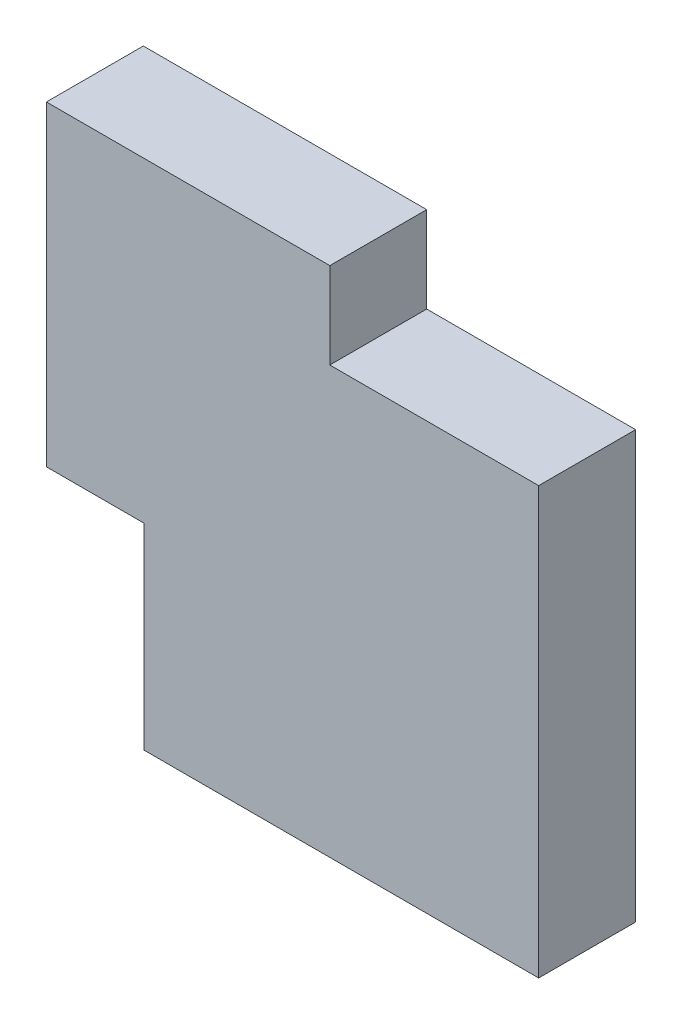
from build123d import *

# Parameters (mm, degrees)
BOSS_EXTRUDE1_DEPTH      = 20
BOSS_EXTRUDE1_DEPTH_BACK = 0.0001
SHELL3_T                 = 3.81
SKETCH9_R                = 1.072598704
BOSS_EXTRUDE3_DEPTH      = 3.001739429
SKETCH19_R               = 1.080792188
BOSS_EXTRUDE4_DEPTH      = 3
BOSS_EXTRUDE5_DEPTH      = 17.32
SKETCH22_W               = 1.806317066
SKETCH22_H               = 1.967276013
SKETCH22_W_2             = 1.806317067
CUT_EXTRUDE1_DEPTH       = 5


with BuildPart() as part:
    # Sketch2 → Boss-Extrude1 (new, two sides: drawn at the far end of the back side and taken through both)
    with BuildSketch(Plane.XY.offset(-BOSS_EXTRUDE1_DEPTH_BACK)):
        Polygon((-6.655720012, 48.566419982), (44.654279988, 48.566419982), (44.654279988, -48.566419982), (-44.654279988, -48.566419982), (-44.654279988, -0.283580018), (-68.655720012, -0.283580018), (-68.655720012, 69.716419982), (-6.655720012, 69.716419982), align=None)
    extrude(amount=BOSS_EXTRUDE1_DEPTH + BOSS_EXTRUDE1_DEPTH_BACK)

    # Shell3
    shell3_openings = [part.faces().sort_by_distance(p)[0] for p in [
        (-10.378060189, 9.486636378, -0.0001),
    ]]
    offset(amount=SHELL3_T, openings=shell3_openings, kind=Kind.INTERSECTION)

    # Sketch9 → Boss-Extrude3 (add)
    with BuildSketch(Plane(origin=(0, 0, 20), x_dir=(-1, 0, 0), z_dir=(0, 0, -1))):
        with BuildLine():
            Line((-44.654279988, 48.566419982), (-38.360252923, 48.566419982))
            ThreePointArc((-38.360252923, 48.566419982), (-40.203730769, 44.115870764), (-44.654279988, 42.272392917))
            Line((-44.654279988, 42.272392917), (-44.654279988, 48.566419982))
        make_face()
        with Locations((-42.441033376, 46.349593762)):
            Circle(SKETCH9_R, mode=Mode.SUBTRACT)
    boss_extrude3 = extrude(amount=BOSS_EXTRUDE3_DEPTH)

    # Mirror1: Boss-Extrude3 across plane
    add(boss_extrude3.mirror(Plane.ZX))

    # Sketch19 → Boss-Extrude4 (add)
    with BuildSketch(Plane(origin=(0, 0, 20), x_dir=(-1, 0, 0), z_dir=(0, 0, -1))):
        with BuildLine():
            ThreePointArc((44.654279988, -43.211645674), (40.867882763, -44.780022757), (39.29950568, -48.566419982))
            Line((39.29950568, -48.566419982), (44.654279988, -48.566419982))
            Line((44.654279988, -48.566419982), (44.654279988, -43.211645674))
        make_face()
        with Locations((42.445754047, -46.356290661)):
            Circle(SKETCH19_R, mode=Mode.SUBTRACT)
    extrude(amount=BOSS_EXTRUDE4_DEPTH)

    # Sketch20 → Boss-Extrude5 (add)
    with BuildSketch(Plane(origin=(0, 0, 20), x_dir=(-1, 0, 0), z_dir=(0, 0, -1))):
        with BuildLine():
            Line((68.655720012, 69.716419982), (68.655720012, 63.716926528))
            ThreePointArc((68.655720012, 63.716926528), (64.413437506, 65.474137477), (62.656226557, 69.716419982))
            Line((62.656226557, 69.716419982), (68.655720012, 69.716419982))
        make_face()
        with BuildLine():
            Line((68.655720012, 5.716419982), (68.655720012, -0.283580018))
            Line((68.655720012, -0.283580018), (62.655720012, -0.283580018))
            ThreePointArc((62.655720012, -0.283580018), (64.413079325, 3.959060669), (68.655720012, 5.716419982))
        make_face()
    extrude(amount=BOSS_EXTRUDE5_DEPTH)

    # Sketch22 → Cut-Extrude1 (cut)
    with BuildSketch(Plane(origin=(0, 0, -0.0001), x_dir=(-1, 0, 0), z_dir=(0, 0, -1))):
        with Locations((46.696837753, -2.332274853)):
            Rectangle(SKETCH22_W, SKETCH22_H)
        with Locations((46.539737407, -50.361848815)):
            Rectangle(SKETCH22_W, SKETCH22_H)
        with Locations((4.657343006, 50.463554198)):
            Rectangle(SKETCH22_W_2, SKETCH22_H)
        with Locations((-46.582637328, 50.219582477)):
            Rectangle(SKETCH22_W_2, SKETCH22_H)
        with Locations((-46.38572761, -50.279884702)):
            Rectangle(SKETCH22_W_2, SKETCH22_H)
    extrude(amount=-CUT_EXTRUDE1_DEPTH, mode=Mode.SUBTRACT)


solid = part.part
